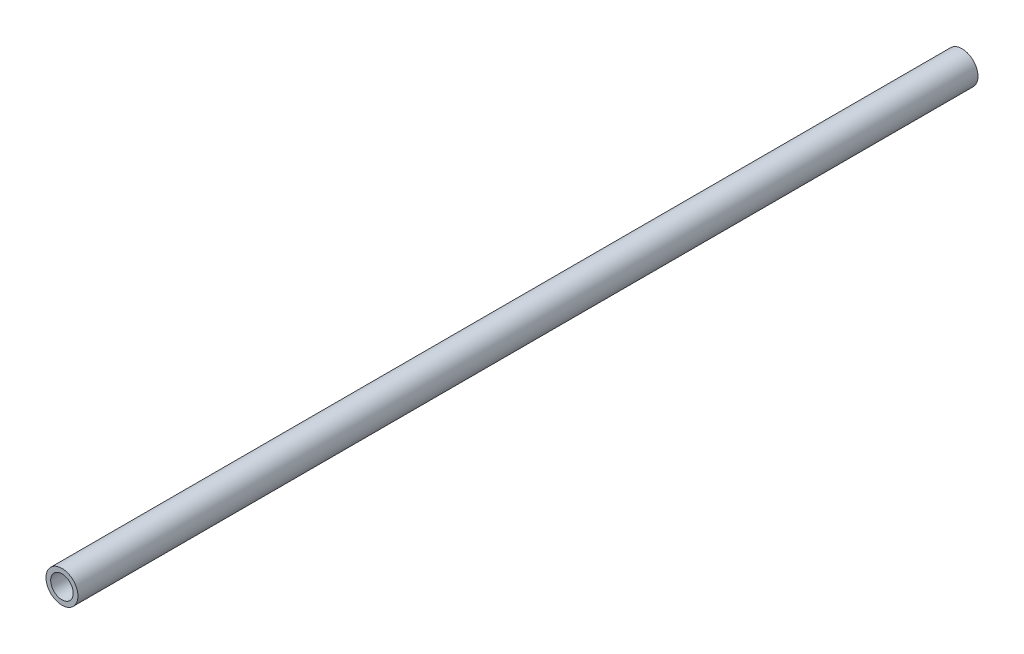
from build123d import *

# Parameters (mm, degrees)
SKIZZE1_R               = 10.65
SKIZZE1_R_2             = 7.5
LINEAR_AUSTRAGEN1_DEPTH = 600


with BuildPart() as part:
    # Skizze1 → Linear austragen1 (new body)
    with BuildSketch(Plane.XY):
        Circle(SKIZZE1_R)
        Circle(SKIZZE1_R_2, mode=Mode.SUBTRACT)
    extrude(amount=LINEAR_AUSTRAGEN1_DEPTH)


solid = part.part
